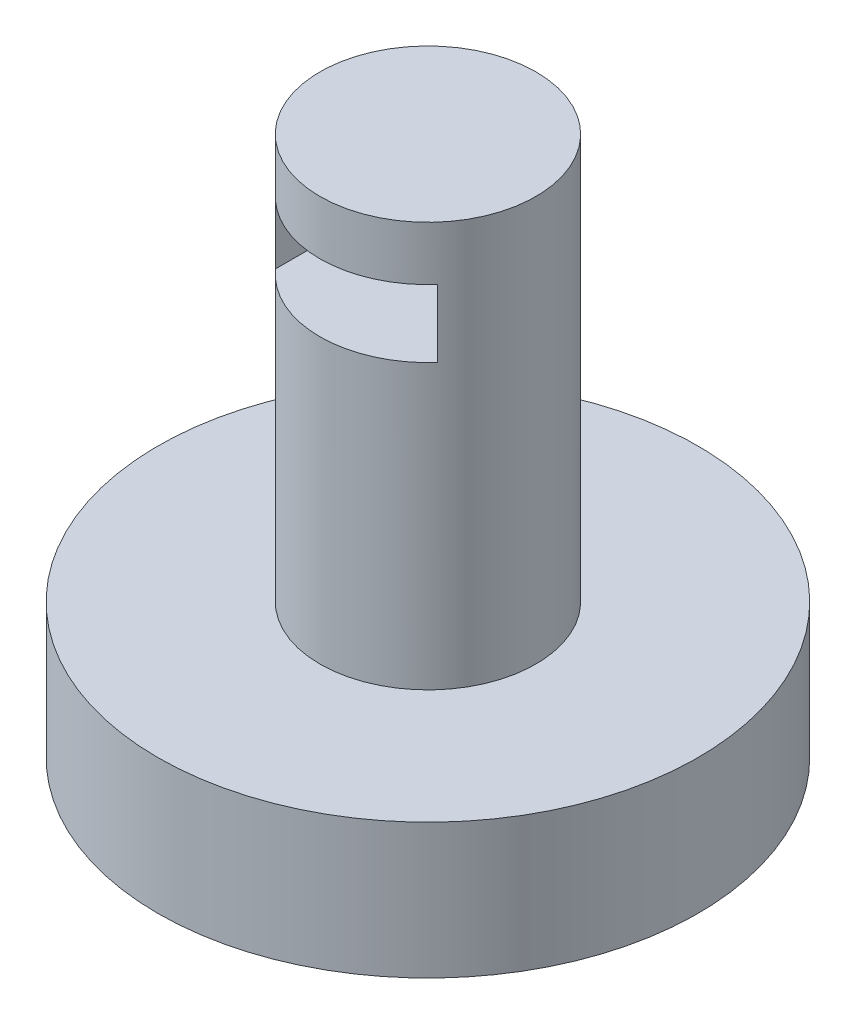
from build123d import *

# Parameters (mm, degrees)
SKETCH2_R               = 20
BOSS_EXTRUDE1_DEPTH     = 10
SKETCH3_R               = 8
BOSS_EXTRUDE2_DEPTH     = 30
CUT_EXTRUDE1_DEPTH      = 49.989794856
CUT_EXTRUDE1_DEPTH_BACK = 49.989794856
SKETCH4_W               = 12
SKETCH4_H               = 5
SKETCH5_R               = 4
CUT_EXTRUDE2_DEPTH      = 3


with BuildPart() as part:
    # Sketch2 → Boss-Extrude1 (new body)
    with BuildSketch(Plane(origin=(0, 0, 0), x_dir=(1, 0, 0), z_dir=(0, 1, 0))):
        with Locations(Location((0, 0, 0), (0, 0, 270))):
            Circle(SKETCH2_R)
    extrude(amount=BOSS_EXTRUDE1_DEPTH)

    # Sketch3 → Boss-Extrude2 (add)
    with BuildSketch(Plane(origin=(0, 10, 0), x_dir=(1, 0, 0), z_dir=(0, 1, 0))):
        with Locations(Location((0, 0, 0), (0, 0, 270))):
            Circle(SKETCH3_R)
    extrude(amount=BOSS_EXTRUDE2_DEPTH)

    # Sketch4 → Cut-Extrude1 (cut, two sides: drawn at the far end of the back side and taken through both)
    with BuildSketch(Plane.XY.offset(-CUT_EXTRUDE1_DEPTH_BACK)):
        with Locations((0, 33.5)):
            Rectangle(SKETCH4_W, SKETCH4_H)
    extrude(amount=CUT_EXTRUDE1_DEPTH + CUT_EXTRUDE1_DEPTH_BACK, mode=Mode.SUBTRACT)

    # Sketch5 → Cut-Extrude2 (cut)
    with BuildSketch(Plane.XZ):
        with Locations(Location((0, 0, 0), (0, 0, 270))):
            Circle(SKETCH5_R)
    extrude(amount=-CUT_EXTRUDE2_DEPTH, mode=Mode.SUBTRACT)


solid = part.part
